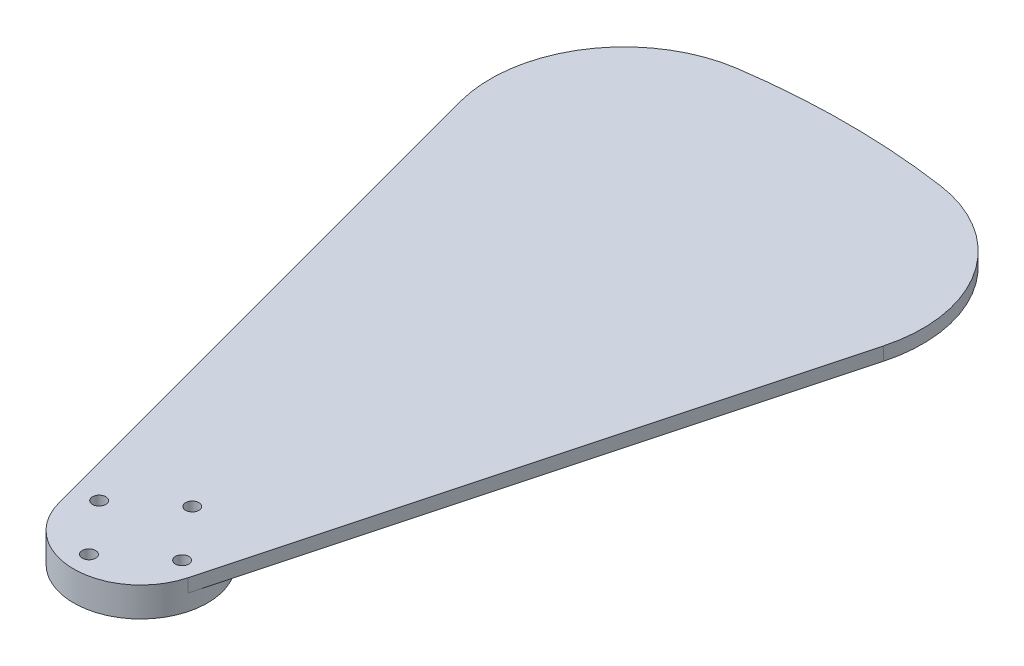
from build123d import *

# Parameters (mm, degrees)
EXTRUDE_1_DEPTH       = 2
EXTRUDE_START         = 2.4
SKETCH_2_R            = 10
EXTRUDE_2_DEPTH       = 2.4
HOLE_WIZARD_2_0_2_1_D = 2
FILLET_1_R            = 20


with BuildPart() as part:
    # 草图1 → 凸台-拉伸1 (new body)
    with BuildSketch(Plane.XZ.offset(-2.4)):
        with BuildLine():
            Line((36.835257999, -98.834021309), (9.659258263, 2.588190451))
            ThreePointArc((9.659258263, 2.588190451), (0, 10), (-9.659258263, 2.588190451))
            Line((-9.659258263, 2.588190451), (-36.835257999, -98.834021309))
            ThreePointArc((-36.835257999, -98.834021309), (0, -105.475115549), (36.835257999, -98.834021309))
        make_face()
    extrude(amount=-EXTRUDE_1_DEPTH)

    # 草图2 → 凸台-拉伸2 (add)
    with BuildSketch(Plane.XZ.offset(-2.4).offset(EXTRUDE_START)):
        with Locations(Location((0, 0, 0), (0, 0, 270))):
            Circle(SKETCH_2_R)
    extrude(amount=-EXTRUDE_2_DEPTH)

    # Ø2.0 (2) 直径孔1 (through all)
    with Locations(Plane(origin=(0, 0, 0), x_dir=(-1, 0, 0), z_dir=(0, -1, 0))):
        with Locations((-6.958391143, -0.762097571), (-0.762097571, 6.958391143), (0.762097571, -6.958391143), (6.958391143, 0.762097571)):
            Hole(HOLE_WIZARD_2_0_2_1_D / 2)

    # 圆角1
    fillet_1_edges = [part.edges().sort_by_distance(p)[0] for p in [
        (-36.835257999, 3.4, -98.834021309),
        (36.835257999, 3.4, -98.834021309),
    ]]
    fillet(fillet_1_edges, radius=FILLET_1_R)


solid = part.part
